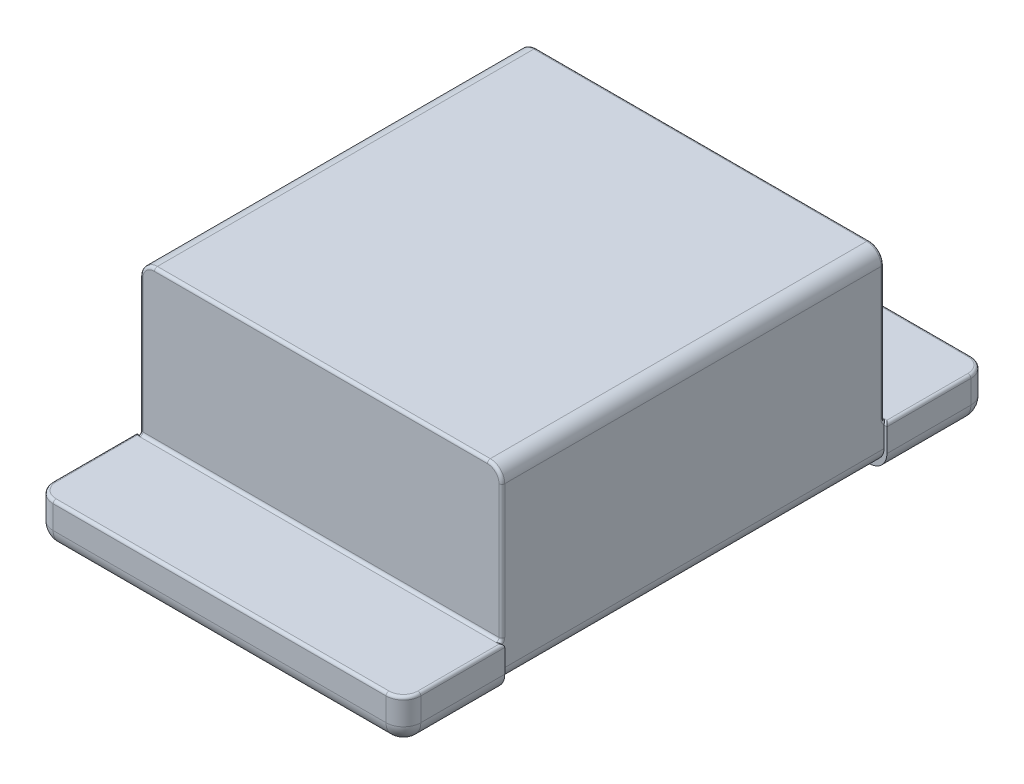
from build123d import *

# Parameters (mm, degrees)
SKETCH1_W               = 1.25
SKETCH1_H               = 2
BOSS_EXTRUDE1_DEPTH     = 0.65
FILLET1_R               = 0.05
BOSS_EXTRUDE2_START     = -0.02
SKETCH2_W               = 1.27
SKETCH2_H               = 0.35
BOSS_EXTRUDE2_DEPTH     = 0.69
FILLET2_R               = 0.06
BOSS_EXTRUDE3_DEPTH     = 0.1
BOSS_EXTRUDE3_2_DEPTH   = 0.1
CUT_EXTRUDE1_DEPTH      = 2.368292732
CUT_EXTRUDE1_DEPTH_BACK = 2.368292732
SKETCH4_OUTSIDE_W       = 4.516
SKETCH4_OUTSIDE_H       = 3.186
FILLET4_R               = 0.01
CUT_EXTRUDE2_DEPTH      = 2.358611423
CUT_EXTRUDE2_DEPTH_BACK = 2.358611423
SKETCH5_W               = 1.47
SKETCH5_H               = 0.44
FILLET5_R               = 0.01
FILLET6_R               = 0.01


with BuildPart() as part:
    # Sketch1 → Boss-Extrude1 (new body)
    with BuildSketch(Plane(origin=(0, 0, 0), x_dir=(1, 0, 0), z_dir=(0, 1, 0))):
        Rectangle(SKETCH1_W, SKETCH1_H)
    extrude(amount=BOSS_EXTRUDE1_DEPTH)

    # Fillet1
    fillet1_edges = [part.edges().sort_by_distance(p)[0] for p in [
        (-0.625, 0.65, 0),
        (0, 0.65, 1),
        (0.625, 0.65, 0),
        (0, 0, 1),
        (-0.625, 0, 0),
        (0, 0, -1),
        (0.625, 0, 0),
        (0, 0.65, -1),
        (0.625, 0.325, 1),
        (-0.625, 0.325, 1),
        (-0.625, 0.325, -1),
        (0.625, 0.325, -1),
    ]]
    fillet(fillet1_edges, radius=FILLET1_R)


with BuildPart() as body_2:
    # Sketch2 → Boss-Extrude2 (new body)
    with BuildSketch(Plane(origin=(0, 0, 0), x_dir=(1, 0, 0), z_dir=(0, 1, 0)).offset(BOSS_EXTRUDE2_START)):
        with Locations((0, 0.835)):
            Rectangle(SKETCH2_W, SKETCH2_H)
    extrude(amount=BOSS_EXTRUDE2_DEPTH)

    # Fillet2
    fillet2_edges = [body_2.edges().sort_by_distance(p)[0] for p in [
        (0.635, -0.02, -0.835),
        (0.635, 0.325, -1.01),
        (0, -0.02, -1.01),
        (0, 0.67, -1.01),
        (-0.635, 0.67, -0.835),
        (0.635, 0.67, -0.835),
        (-0.635, 0.325, -1.01),
        (-0.635, -0.02, -0.835),
    ]]
    fillet(fillet2_edges, radius=FILLET2_R)


with BuildPart() as body_3:
    # Mirror1: mirrored copy
    add(body_2.part.mirror(Plane.XY))


with BuildPart() as body_4:
    # Sketch3 → Boss-Extrude3 (new body)
    with BuildSketch(Plane(origin=(0, 0, 0), x_dir=(1, 0, 0), z_dir=(0, 1, 0))):
        Polygon((-0.575, 0.95), (-0.575, 0), (-0.281388944, 0.293611056), (0.281388944, 0.293611056), (0.575, 0), (0.575, 0.95), align=None)
    extrude(amount=BOSS_EXTRUDE3_DEPTH)


with BuildPart() as body_5:
    # Sketch3 → Boss-Extrude3 2 (new body)
    with BuildSketch(Plane(origin=(0, 0, 0), x_dir=(1, 0, 0), z_dir=(0, 1, 0))):
        with BuildLine():
            Line((-0.258661904, -0.030439885), (-0.575, -0.163104061))
            Line((-0.575, -0.163104061), (-0.575, -0.418795876))
            Line((-0.575, -0.418795876), (0.475, -0.418795876))
            Line((0.475, -0.418795876), (0.475, -0.518795876))
            Line((0.475, -0.518795876), (-0.575, -0.518795876))
            Line((-0.575, -0.518795876), (-0.575, -0.95))
            Line((-0.575, -0.95), (0.575, -0.95))
            Line((0.575, -0.95), (0.575, -0.318795876))
            Line((0.575, -0.318795876), (-0.475, -0.318795876))
            Line((-0.475, -0.318795876), (-0.475, -0.229604371))
            Line((-0.475, -0.229604371), (-0.227942704, -0.125994806))
            ThreePointArc((-0.227942704, -0.125994806), (0.24794898, 0.079711169), (-0.258661904, -0.030439885))
        make_face()
    extrude(amount=BOSS_EXTRUDE3_2_DEPTH)


with BuildPart() as cut_extrude1_tool:
    # Sketch4 outside → Cut-Extrude1 (new, two sides: drawn at the far end of the back side and taken through both)
    with BuildSketch(Plane(origin=(0, 0, 0), x_dir=(0, 0, -1), z_dir=(1, 0, 0)).offset(-CUT_EXTRUDE1_DEPTH_BACK)):
        with Locations((0, 0.325)):
            Rectangle(SKETCH4_OUTSIDE_W, SKETCH4_OUTSIDE_H)
        Polygon((-1.11, 0.13), (-0.66, 0.13), (-0.66, 0.77), (0.66, 0.77), (0.66, 0.13), (1.11, 0.13), (1.11, -0.12), (-1.11, -0.12), align=None, mode=Mode.SUBTRACT)
    extrude(amount=CUT_EXTRUDE1_DEPTH + CUT_EXTRUDE1_DEPTH_BACK)


with BuildPart() as part_1:
    add(part.part)

    # Cut-Extrude1: cut by cut_extrude1_tool
    add(cut_extrude1_tool.part, mode=Mode.SUBTRACT)

    # Fillet4
    fillet4_edges = [part_1.edges().sort_by_distance(p)[0] for p in [
        (0.610355339, 0.13, -0.985355339),
        (0.610355339, 0.635355339, -0.66),
        (0.610355339, 0.635355339, 0.66),
        (0.610355339, 0.13, 0.985355339),
        (0, 0.13, 0.66),
        (-0.610355339, 0.13, 0.985355339),
        (-0.610355339, 0.635355339, 0.66),
        (0, 0.65, 0.66),
        (0, 0.13, -0.66),
        (0, 0.65, -0.66),
        (-0.610355339, 0.635355339, -0.66),
        (-0.610355339, 0.13, -0.985355339),
        (-0.625, 0.13, 0.805),
        (0, 0.13, 1),
        (0.625, 0.13, 0.805),
        (-0.625, 0.365, 0.66),
        (0.625, 0.365, 0.66),
        (-0.625, 0.365, -0.66),
        (0.625, 0.365, -0.66),
        (-0.625, 0.13, -0.805),
        (0.625, 0.13, -0.805),
        (0, 0.13, -1),
    ]]
    fillet(fillet4_edges, radius=FILLET4_R)


with BuildPart() as body_2_1:
    add(body_2.part)

    # Cut-Extrude1: cut by cut_extrude1_tool
    add(cut_extrude1_tool.part, mode=Mode.SUBTRACT)

    # Fillet6
    fillet6_edges = [body_2_1.edges().sort_by_distance(p)[0] for p in [
        (-0.617426407, 0.13, -0.992426407),
        (-0.635, 0.13, -0.805),
        (0, 0.13, -1.01),
        (0, 0.13, -0.66),
        (0.617426407, 0.13, -0.992426407),
        (0.635, 0.13, -0.805),
    ]]
    fillet(fillet6_edges, radius=FILLET6_R)


with BuildPart() as body_3_1:
    add(body_3.part)

    # Cut-Extrude1: cut by cut_extrude1_tool
    add(cut_extrude1_tool.part, mode=Mode.SUBTRACT)

    # Fillet5
    fillet5_edges = [body_3_1.edges().sort_by_distance(p)[0] for p in [
        (-0.617426407, 0.13, 0.992426407),
        (0, 0.13, 1.01),
        (-0.635, 0.13, 0.805),
        (0.635, 0.13, 0.805),
        (0.617426407, 0.13, 0.992426407),
        (0, 0.13, 0.66),
    ]]
    fillet(fillet5_edges, radius=FILLET5_R)


with BuildPart() as cut_extrude2_tool:
    # Sketch5 → Cut-Extrude2 (new, two sides: drawn at the far end of the back side and taken through both)
    with BuildSketch(Plane(origin=(0, 0, 0), x_dir=(1, 0, 0), z_dir=(0, 1, 0)).offset(-CUT_EXTRUDE2_DEPTH_BACK)):
        with Locations((0, 0.89)):
            Rectangle(SKETCH5_W, SKETCH5_H)
        with Locations((0, -0.89)):
            Rectangle(SKETCH5_W, SKETCH5_H)
    extrude(amount=CUT_EXTRUDE2_DEPTH + CUT_EXTRUDE2_DEPTH_BACK)


with BuildPart() as part_2:
    add(part_1.part)

    # Cut-Extrude2: cut by cut_extrude2_tool
    add(cut_extrude2_tool.part, mode=Mode.SUBTRACT)


with BuildPart() as body_5_1:
    add(body_5.part)

    # Cut-Extrude2: cut by cut_extrude2_tool
    add(cut_extrude2_tool.part, mode=Mode.SUBTRACT)


solid = Compound([body_4.part, body_2_1.part, body_3_1.part, part_2.part, body_5_1.part])
